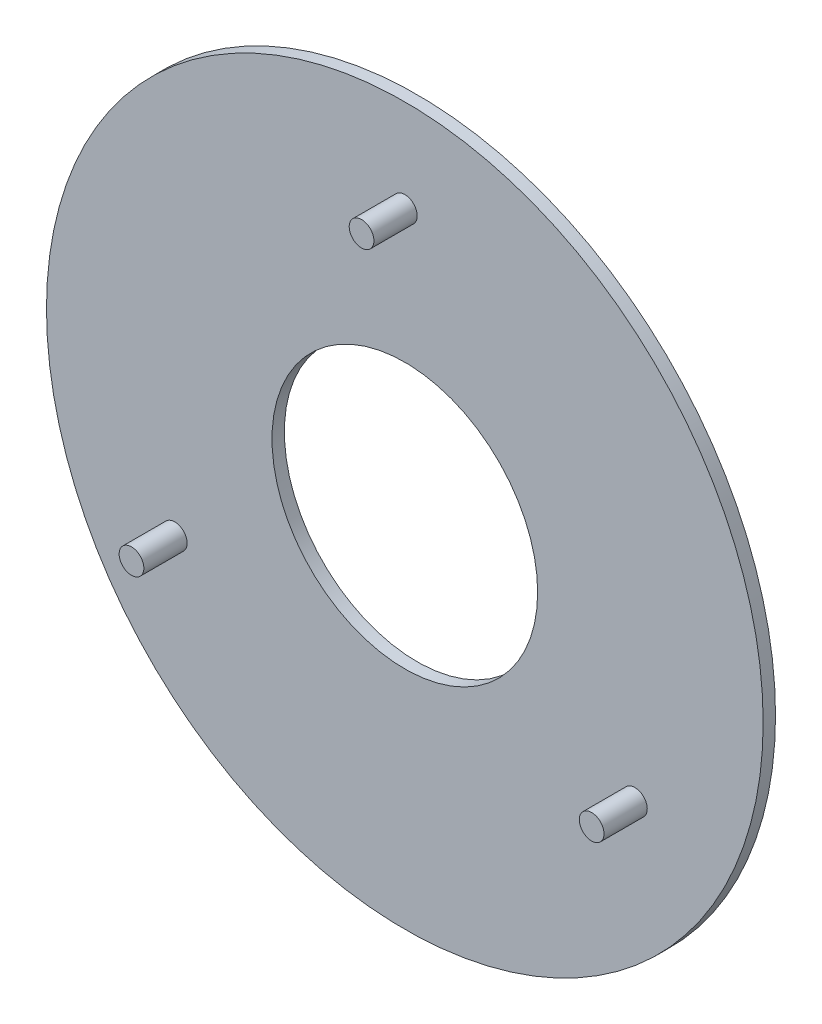
from build123d import *

# Parameters (mm, degrees)
SKETCH1_R           = 58
BOSS_EXTRUDE1_DEPTH = 2
SKETCH2_R           = 2
BOSS_EXTRUDE2_DEPTH = 7
CIRPATTERN1_COUNT   = 3
SKETCH1_3_R         = 21.5
CUT_EXTRUDE1_DEPTH  = 83.322536404


with BuildPart() as part:
    # Sketch1 → Boss-Extrude1 (new body)
    with BuildSketch(Plane.XY):
        Circle(SKETCH1_R)
    extrude(amount=-BOSS_EXTRUDE1_DEPTH)

    # Sketch2 → Boss-Extrude2 (add)
    with BuildSketch(Plane.XY):
        with Locations((0, 43)):
            Circle(SKETCH2_R)
    boss_extrude2 = extrude(amount=BOSS_EXTRUDE2_DEPTH)

    # CirPattern1: Boss-Extrude2 ×3 about axis
    cirpattern1_axis = Axis((0, 0, 0), (0, 0, -1))
    for i in range(1, CIRPATTERN1_COUNT):
        add(boss_extrude2.rotate(cirpattern1_axis, i * 360 / CIRPATTERN1_COUNT))

    # Sketch1<3> → Cut-Extrude1 (cut, through all)
    with BuildSketch(Plane.XY):
        Circle(SKETCH1_3_R)
    extrude(amount=-CUT_EXTRUDE1_DEPTH, mode=Mode.SUBTRACT)


solid = part.part
